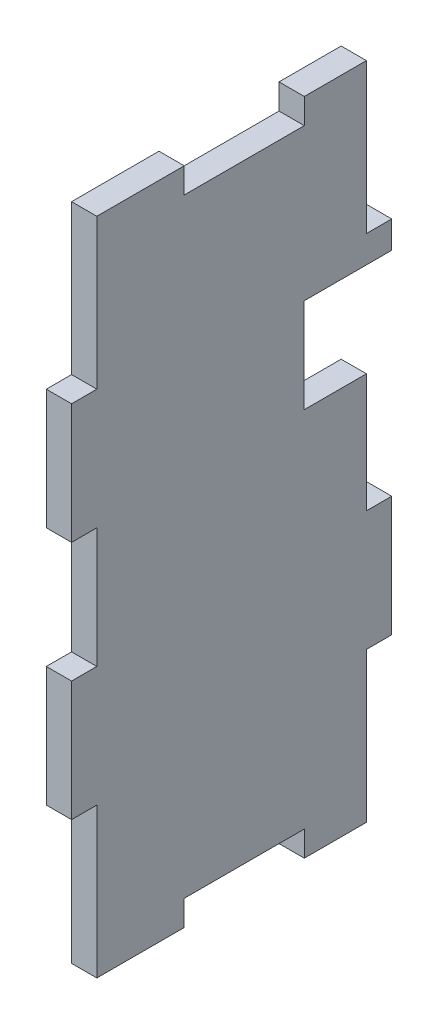
from build123d import *

# Parameters (mm, degrees)
BOSS_EXTRUDE1_DEPTH = 3
SKETCH2_W           = 11
SKETCH2_H           = 11.192112216
CUT_EXTRUDE1_DEPTH  = 10


with BuildPart() as part:
    # Sketch1 → Boss-Extrude1 (new body)
    with BuildSketch(Plane(origin=(0, 0, 0), x_dir=(0, 0, -1), z_dir=(1, 0, 0))):
        Polygon((-18.557859796, 36.983092069), (-18.557859796, 19.208092069), (-21.557859796, 19.208092069), (-21.557859796, 4.958092069), (-18.557859796, 4.958092069), (-18.557859796, -9.291907931), (-21.557859796, -9.291907931), (-21.557859796, -23.541907931), (-18.557859796, -23.541907931), (-18.557859796, -37.791907931), (-18.557859796, -41.316907931), (-8.182859796, -41.316907931), (-8.182859796, -38.316907931), (6.067140204, -38.316907931), (6.067140204, -41.316907931), (13.442140204, -41.316907931), (13.442140204, -23.541907931), (16.442140204, -23.541907931), (16.442140204, -9.291907931), (13.442140204, -9.291907931), (13.442140204, 4.958092069), (16.442140204, 4.958092069), (16.442140204, 19.208092069), (13.442140204, 19.208092069), (13.442140204, 33.458092069), (13.442140204, 36.983092069), (6.067140204, 36.983092069), (6.067140204, 33.983092069), (-8.182859796, 33.983092069), (-8.182859796, 36.983092069), align=None)
    extrude(amount=BOSS_EXTRUDE1_DEPTH)

    # Sketch2 → Cut-Extrude1 (cut)
    with BuildSketch(Plane(origin=(3, 0, 0), x_dir=(0, 0, -1), z_dir=(1, 0, 0))):
        with Locations((11.545501323, 10.387035961)):
            Rectangle(SKETCH2_W, SKETCH2_H)
    extrude(amount=-CUT_EXTRUDE1_DEPTH, mode=Mode.SUBTRACT)


solid = part.part
